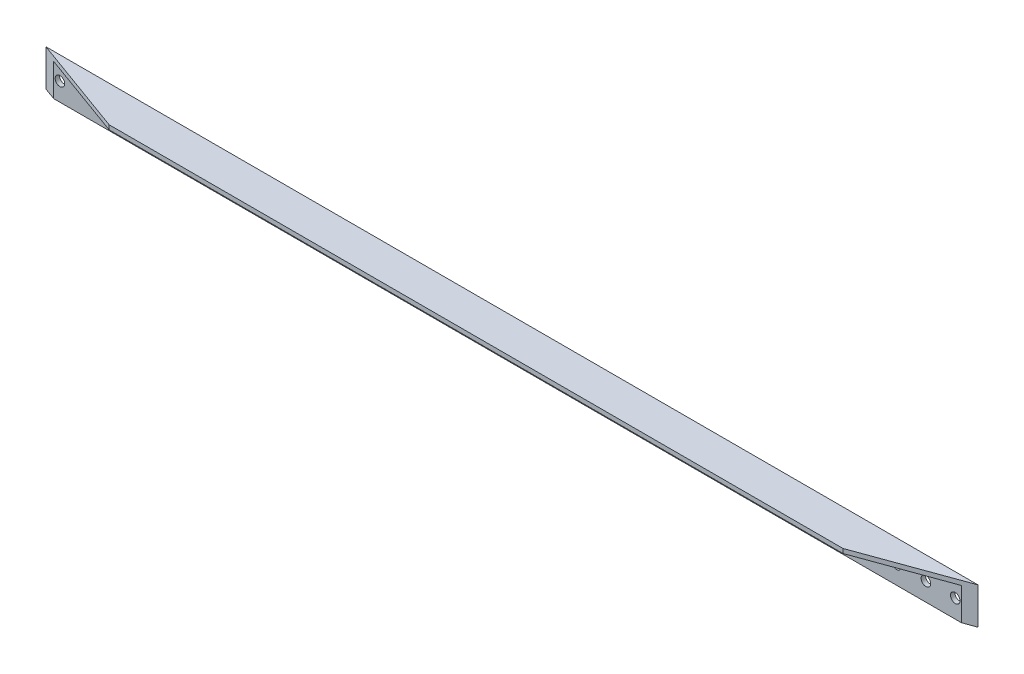
from build123d import *

# Parameters (mm, degrees)
SKETCH_1_W          = 2540
SKETCH_1_H          = 100
SKETCH_1_R          = 13
EXTRUDE_569_DEPTH   = 12
SKETCH_2_W          = 2540
SKETCH_2_H          = 12
EXTRUDE_1_DEPTH     = 86
CUT_EXTRUDE_1_DEPTH = 1278.694799238


with BuildPart() as part:
    # 草图1 → Extrude 569 (new body)
    with BuildSketch(Plane.XY):
        Rectangle(SKETCH_1_W, SKETCH_1_H)
        with Locations((1220, 0)):
            Circle(SKETCH_1_R, mode=Mode.SUBTRACT)
        with Locations((1140, 0)):
            Circle(SKETCH_1_R, mode=Mode.SUBTRACT)
        with Locations((1060, 0)):
            Circle(SKETCH_1_R, mode=Mode.SUBTRACT)
        with Locations((980, 0)):
            Circle(SKETCH_1_R, mode=Mode.SUBTRACT)
        with Locations((580, 0)):
            Circle(SKETCH_1_R, mode=Mode.SUBTRACT)
        with Locations((460, 0)):
            Circle(SKETCH_1_R, mode=Mode.SUBTRACT)
        with Locations((380, 0)):
            Circle(SKETCH_1_R, mode=Mode.SUBTRACT)
        with Locations((300, 0)):
            Circle(SKETCH_1_R, mode=Mode.SUBTRACT)
        with Locations((180, 0)):
            Circle(SKETCH_1_R, mode=Mode.SUBTRACT)
        with Locations(Location((-180, 0, 0), (0, 0, 180))):
            Circle(SKETCH_1_R, mode=Mode.SUBTRACT)
        with Locations(Location((-300, 0, 0), (0, 0, 180))):
            Circle(SKETCH_1_R, mode=Mode.SUBTRACT)
        with Locations(Location((-380, 0, 0), (0, 0, 180))):
            Circle(SKETCH_1_R, mode=Mode.SUBTRACT)
        with Locations(Location((-460, 0, 0), (0, 0, 180))):
            Circle(SKETCH_1_R, mode=Mode.SUBTRACT)
        with Locations(Location((-580, 0, 0), (0, 0, 180))):
            Circle(SKETCH_1_R, mode=Mode.SUBTRACT)
        with Locations(Location((-980, 0, 0), (0, 0, 180))):
            Circle(SKETCH_1_R, mode=Mode.SUBTRACT)
        with Locations(Location((-1060, 0, 0), (0, 0, 180))):
            Circle(SKETCH_1_R, mode=Mode.SUBTRACT)
        with Locations(Location((-1140, 0, 0), (0, 0, 180))):
            Circle(SKETCH_1_R, mode=Mode.SUBTRACT)
        with Locations(Location((-1220, 0, 0), (0, 0, 180))):
            Circle(SKETCH_1_R, mode=Mode.SUBTRACT)
    extrude(amount=EXTRUDE_569_DEPTH)

    # 草图2 → 凸台-拉伸1 (add)
    with BuildSketch(Plane.XY.offset(12)):
        with Locations((0, 44)):
            Rectangle(SKETCH_2_W, SKETCH_2_H)
    extrude(amount=EXTRUDE_1_DEPTH)

    # 草图4 → 切除-拉伸1 (cut, through all)
    with BuildSketch(Plane(origin=(0, 50, 0), x_dir=(-1, 0, 0), z_dir=(0, 1, 0))):
        Polygon((-1270, 0), (-1270, 98), (-1000, 98), align=None)
        Polygon((1270, 0), (1000, 98), (1270, 98), align=None)
    extrude(amount=-CUT_EXTRUDE_1_DEPTH, mode=Mode.SUBTRACT)


solid = part.part
